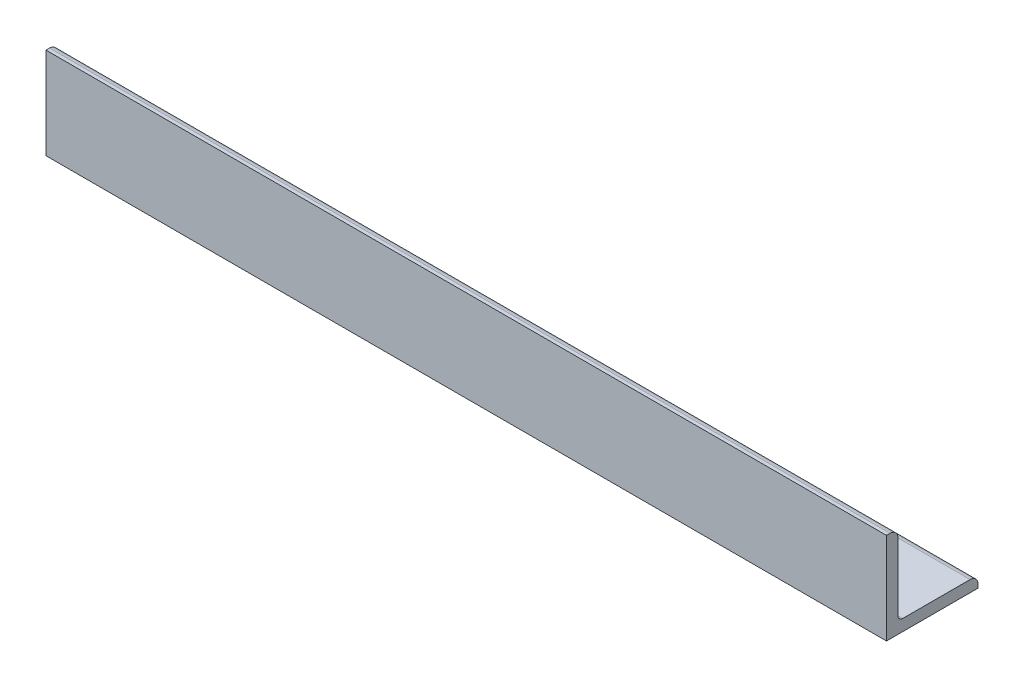
from build123d import *

# Parameters (mm, degrees)
A_O_CANTONEIRA_LAMINADA_1020_3_16X1_1_2_DEPTH = 350
ESBO_O4_R                                     = 4
CORTE_EXTRUS_O1_DEPTH                         = 184.107127114


with BuildPart() as part:
    # Sketch11 → Aço cantoneira laminada 1020 3-16X1-1-2(1) (new body)
    with BuildSketch(Plane(origin=(-175, 0, 0), x_dir=(0, 0, -1), z_dir=(1, 0, 0))):
        with BuildLine():
            Line((0, 0), (0, 38.1))
            Line((0, 38.1), (1.5, 38.1))
            ThreePointArc((1.5, 38.1), (3.806935874, 37.144435874), (4.7625, 34.8375))
            Line((4.7625, 34.8375), (4.7625, 6.7625))
            ThreePointArc((4.7625, 6.7625), (5.348286438, 5.348286438), (6.7625, 4.7625))
            Line((6.7625, 4.7625), (34.8375, 4.7625))
            ThreePointArc((34.8375, 4.7625), (37.144435874, 3.806935874), (38.1, 1.5))
            Line((38.1, 1.5), (38.1, 0))
            Line((38.1, 0), (0, 0))
        make_face()
    extrude(amount=A_O_CANTONEIRA_LAMINADA_1020_3_16X1_1_2_DEPTH)

    # Esboço4 → Corte-extrusão1 (cut, through all)
    with BuildSketch(Plane(origin=(0, 0, 0), x_dir=(1, 0, 0), z_dir=(0, 1, 0))):
        with Locations(Location((-87.5, 19.76, 0), (0, 0, 90))):
            Circle(ESBO_O4_R)
        with Locations(Location((87.5, 19.76, 0), (0, 0, 90))):
            Circle(ESBO_O4_R)
        with BuildLine():
            Line((-5, 12), (-5, 26.1))
            ThreePointArc((-5, 26.1), (0, 31.1), (5, 26.1))
            Line((5, 26.1), (5, 12))
            ThreePointArc((5, 12), (0, 7), (-5, 12))
        make_face()
    extrude(amount=CORTE_EXTRUS_O1_DEPTH, mode=Mode.SUBTRACT)


solid = part.part
